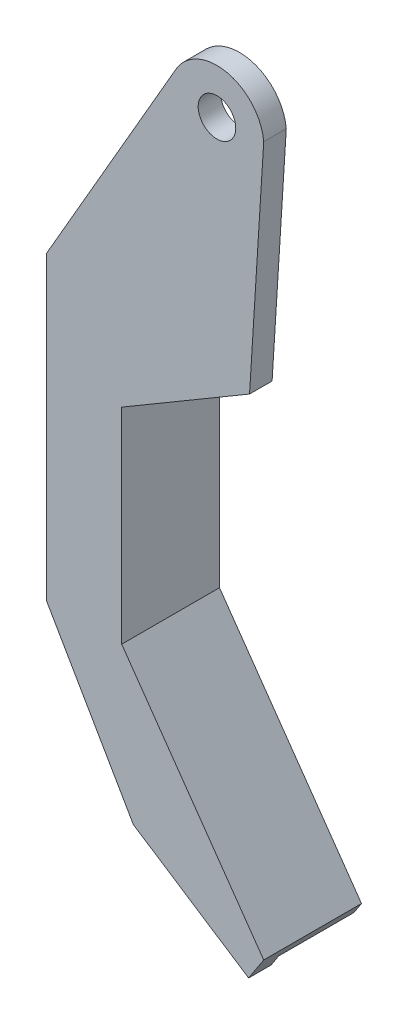
from build123d import *

# Parameters (mm, degrees)
EXTRUDE_4_DEPTH     = 3
SKETCH_2_R          = 2.5
CUT_EXTRUDE_1_DEPTH = 72.936469634
EXTRUDE_6_DEPTH     = 10


with BuildPart() as part:
    # 草图1 → 凸台-拉伸4 (new body)
    with BuildSketch(Plane.XY):
        with BuildLine():
            ThreePointArc((11.999755772, 64.190702015), (7.19287537, 69.699227744), (0.441332655, 66.894477154))
            Line((0.441332655, 66.894477154), (-16.87917542, 36.894477154))
            Line((-16.87917542, 36.894477154), (-16.87917542, -3.105522846))
            Line((-16.87917542, -3.105522846), (-5.332170037, -23.105522846))
            Line((-5.332170037, -23.105522846), (9.992741519, -33.105522846))
            Line((9.992741519, -33.105522846), (11.999755772, -30.029791253))
            Line((11.999755772, -30.029791253), (-6.87917542, -3.105522846))
            Line((-6.87917542, -3.105522846), (-6.87917542, 14.190702015))
            Line((-6.87917542, 14.190702015), (-6.87917542, 24.190702015))
            Line((-6.87917542, 24.190702015), (10.114332844, 34.190702015))
            Line((10.114332844, 34.190702015), (11.999755772, 64.190702015))
        make_face()
    extrude(amount=EXTRUDE_4_DEPTH)

    # 草图2 → 切除-拉伸1 (cut, through all)
    with BuildSketch(Plane.XY):
        with Locations((5.784422652, 63.881230161)):
            Circle(SKETCH_2_R)
    extrude(amount=CUT_EXTRUDE_1_DEPTH, mode=Mode.SUBTRACT)

    # 草图6 → 凸台-拉伸6 (add)
    with BuildSketch(Plane(origin=(0, 0, 0), x_dir=(-1, 0, 0), z_dir=(0, 0, -1))):
        Polygon((6.87917542, 24.190702015), (8.248400541, 24.190702015), (8.248400541, -3.145484966), (-10.996248645, -31.567657049), (-11.999755772, -30.029791253), (6.87917542, -3.105522846), align=None)
    extrude(amount=EXTRUDE_6_DEPTH)


solid = part.part
